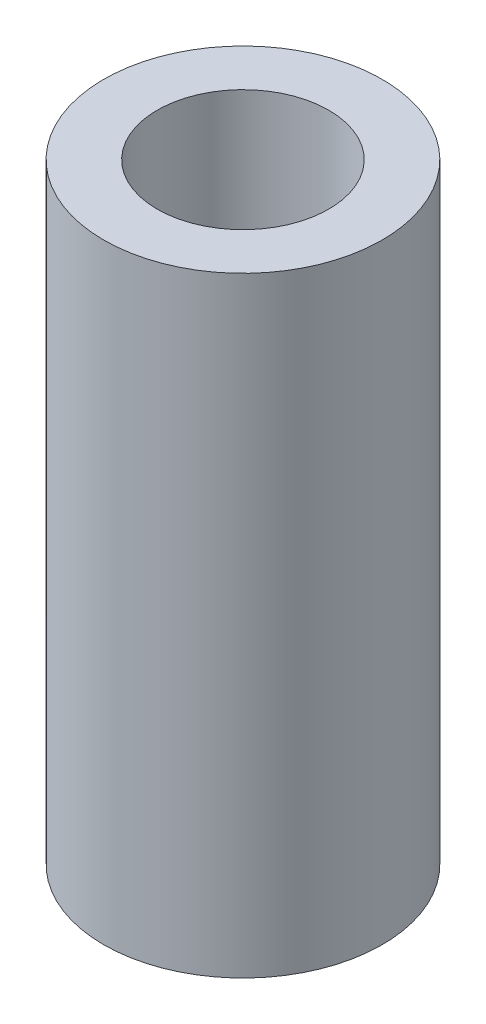
from build123d import *

# Parameters (mm, degrees)
SKETCH_1_R      = 4.95
SKETCH_1_R_2    = 3.05
EXTRUDE_1_DEPTH = 21.7


with BuildPart() as part:
    # 草图1 → 凸台-拉伸1 (new body)
    with BuildSketch(Plane(origin=(0, 0, 0), x_dir=(1, 0, 0), z_dir=(0, 1, 0))):
        with Locations(Location((0, 0, 0), (0, 0, 270))):
            Circle(SKETCH_1_R)
        with Locations(Location((0, 0, 0), (0, 0, 270))):
            Circle(SKETCH_1_R_2, mode=Mode.SUBTRACT)
    extrude(amount=EXTRUDE_1_DEPTH)


solid = part.part
